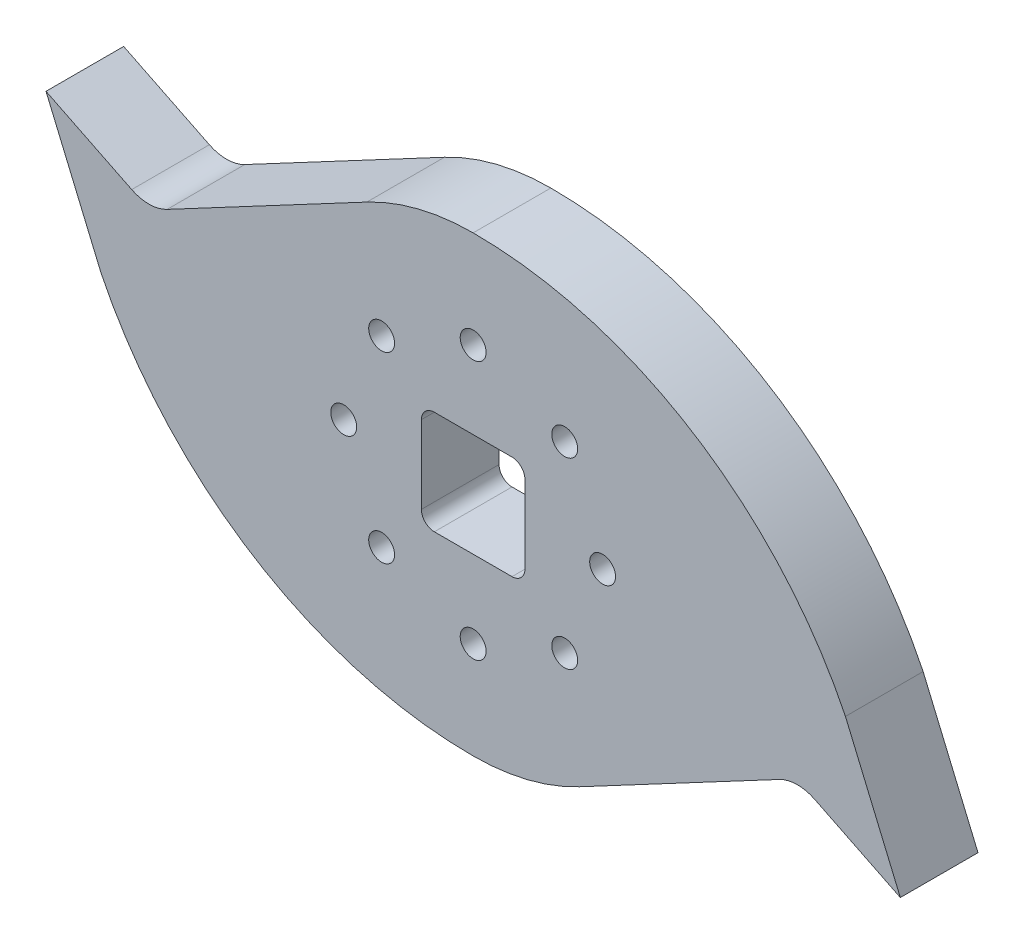
from build123d import *

# Parameters (mm, degrees)
EXTRUDE_1_DEPTH     = 6
SKETCH_2_R          = 1
CUT_EXTRUDE_1_DEPTH = 38.831864876


with BuildPart() as part:
    # 草图1 → 凸台-拉伸1 (new body)
    with BuildSketch(Plane.XY):
        with BuildLine():
            Line((8.215752349, -15.451582875), (23.643338017, -7.248590067))
            ThreePointArc((23.643338017, -7.248590067), (25.005690113, -6.897786494), (26.378171201, -7.206593948))
            Line((26.378171201, -7.206593948), (33, -10.470749302))
            Line((33, -10.470749302), (28.760739296, -0.470749302))
            ThreePointArc((28.760739296, -0.470749302), (16.956768231, 12.637944122), (0, 17.5))
            ThreePointArc((0, 17.5), (-4.233633173, 16.98017521), (-8.215752349, 15.451582875))
            Line((-8.215752349, 15.451582875), (-23.643338017, 7.248590067))
            ThreePointArc((-23.643338017, 7.248590067), (-25.005690113, 6.897786494), (-26.378171201, 7.206593948))
            Line((-26.378171201, 7.206593948), (-33, 10.470749302))
            Line((-33, 10.470749302), (-28.760739296, 0.470749302))
            ThreePointArc((-28.760739296, 0.470749302), (-16.956768231, -12.637944122), (0, -17.5))
            ThreePointArc((0, -17.5), (4.233633173, -16.98017521), (8.215752349, -15.451582875))
        make_face()
        with BuildLine():
            Line((-3, -4), (3, -4))
            ThreePointArc((3, -4), (3.707106781, -3.707106781), (4, -3))
            Line((4, -3), (4, 3))
            ThreePointArc((4, 3), (3.707106781, 3.707106781), (3, 4))
            Line((3, 4), (-3, 4))
            ThreePointArc((-3, 4), (-3.707106781, 3.707106781), (-4, 3))
            Line((-4, 3), (-4, -3))
            ThreePointArc((-4, -3), (-3.707106781, -3.707106781), (-3, -4))
        make_face(mode=Mode.SUBTRACT)
    extrude(amount=EXTRUDE_1_DEPTH)

    # 草图2 → 切除-拉伸1 (cut, through all)
    with BuildSketch(Plane.XY.offset(6)):
        with Locations((0, 10)):
            Circle(SKETCH_2_R)
        with Locations((7.071067812, 7.071067812)):
            Circle(SKETCH_2_R)
        with Locations((10, 0)):
            Circle(SKETCH_2_R)
        with Locations((7.071067812, -7.071067812)):
            Circle(SKETCH_2_R)
        with Locations((0, -10)):
            Circle(SKETCH_2_R)
        with Locations((-7.071067812, -7.071067812)):
            Circle(SKETCH_2_R)
        with Locations((-10, 0)):
            Circle(SKETCH_2_R)
        with Locations((-7.071067812, 7.071067812)):
            Circle(SKETCH_2_R)
    extrude(amount=-CUT_EXTRUDE_1_DEPTH, mode=Mode.SUBTRACT)


solid = part.part
